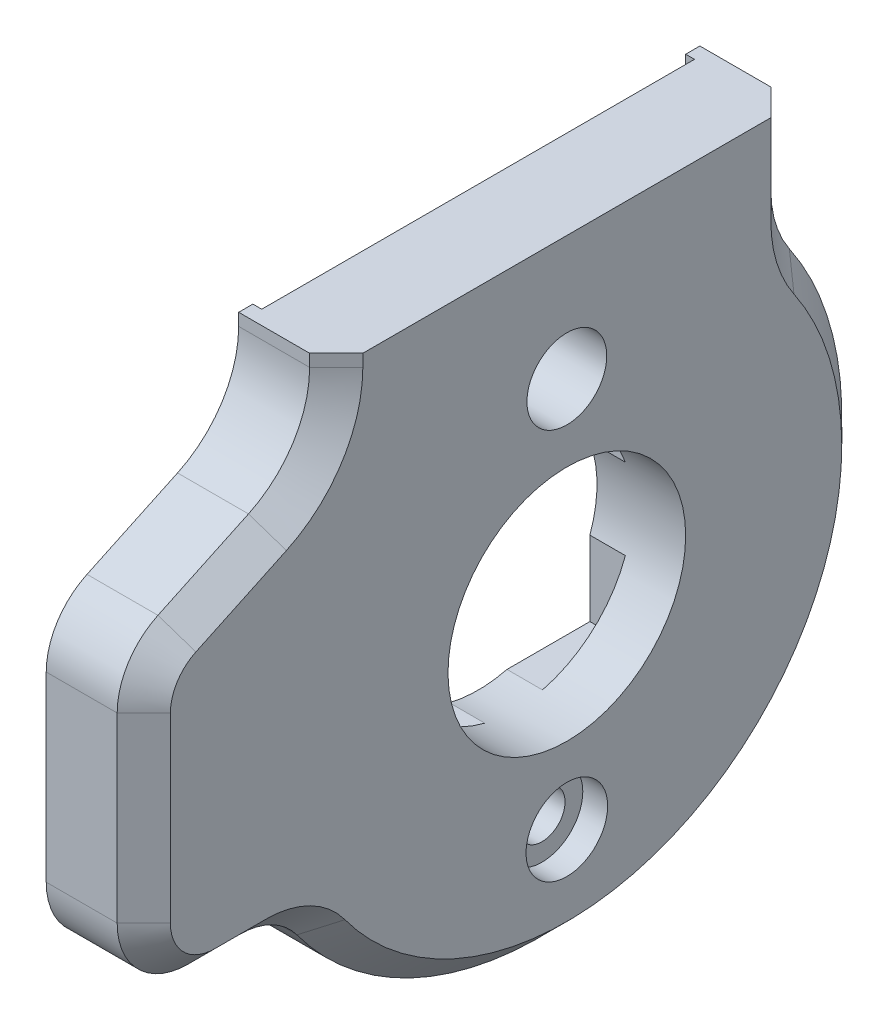
from build123d import *

# Parameters (mm, degrees)
BOSS_EXTRUDE1_START  = 55.1
BOSS_EXTRUDE1_DEPTH  = 5.5
BOSS_EXTRUDE2_START  = 55
BOSS_EXTRUDE2_DEPTH  = 0.6
CHAMFER1_SIZE        = 1.5
BOSS_EXTRUDE3_START  = 55.875
SKETCH3_W            = 4.1
SKETCH3_H            = 2
BOSS_EXTRUDE3_DEPTH  = 2.9
BOSS_EXTRUDE4_START  = 84.025
SKETCH4_W            = 4.1
SKETCH4_H            = 2
BOSS_EXTRUDE4_DEPTH  = 2.9
BOSS_EXTRUDE5_START  = 59.7
SKETCH5_W            = 2.1
SKETCH5_H            = 13
BOSS_EXTRUDE5_DEPTH  = 23.4
BOSS_EXTRUDE6_START  = 55.5
SKETCH6_R            = 6.7
BOSS_EXTRUDE6_DEPTH  = 5.6
BOSS_EXTRUDE7_START  = 55.5
SKETCH7_R            = 2.25
BOSS_EXTRUDE7_DEPTH  = 5.6
BOSS_EXTRUDE8_START  = 59.2
SKETCH8_R            = 2.3
BOSS_EXTRUDE8_DEPTH  = 1.9
BOSS_EXTRUDE9_START  = 55.5
SKETCH9_R            = 1.3
BOSS_EXTRUDE9_DEPTH  = 3.75
BOSS_EXTRUDE10_START = 26
SKETCH10_W           = 30
SKETCH10_H           = 62
BOSS_EXTRUDE10_DEPTH = 80


with BuildPart() as part:
    # Sketch1 → Boss-Extrude1 (new body)
    with BuildSketch(Plane(origin=(0, 0, 0), x_dir=(0, 0, -1), z_dir=(1, 0, 0)).offset(BOSS_EXTRUDE1_START)):
        with BuildLine():
            Line((-53, 3.337121701), (-53, -7.038518603))
            ThreePointArc((-53, -7.038518603), (-52.733198515, -8.807822077), (-51.956521739, -10.41977462))
            ThreePointArc((-51.956521739, -10.41977462), (-56.18950583, -33.883594784), (-79.719936005, -30.038095238))
            ThreePointArc((-79.719936005, -30.038095238), (-81.138131249, -28.832955071), (-82.948156242, -28.4))
            Line((-82.948156242, -28.4), (-85.85, -28.4))
            ThreePointArc((-85.85, -28.4), (-88.678427125, -27.228427125), (-89.85, -24.4))
            Line((-89.85, -24.4), (-89.85, -14.139667829))
            ThreePointArc((-89.85, -14.139667829), (-89.226856881, -11.995644133), (-87.551581196, -10.519637244))
            Line((-87.551581196, -10.519637244), (-82.447628205, -8.120544133))
            ThreePointArc((-82.447628205, -8.120544133), (-79.934714679, -5.9065338), (-79, -2.690498257))
            Line((-79, -2.690498257), (-79, 3.337121701))
            ThreePointArc((-79, 3.337121701), (-79.321091654, 5.273613374), (-80.25, 7.002841276))
            ThreePointArc((-80.25, 7.002841276), (-66, 36), (-51.75, 7.002841276))
            ThreePointArc((-51.75, 7.002841276), (-52.678908346, 5.273613374), (-53, 3.337121701))
        make_face()
    extrude(amount=BOSS_EXTRUDE1_DEPTH)


with BuildPart() as body_2:
    # Sketch2 → Boss-Extrude2 (new body)
    with BuildSketch(Plane(origin=(0, 0, 0), x_dir=(0, 0, -1), z_dir=(1, 0, 0)).offset(BOSS_EXTRUDE2_START)):
        with BuildLine():
            Line((-53.8, 3.337121701), (-53.8, -7.038518603))
            ThreePointArc((-53.8, -7.038518603), (-53.497624984, -9.043729207), (-52.617391304, -10.870608755))
            ThreePointArc((-52.617391304, -10.870608755), (-56.651176143, -33.230249147), (-79.074291958, -29.565714286))
            ThreePointArc((-79.074291958, -29.565714286), (-80.77612625, -28.119546085), (-82.948156242, -27.6))
            Line((-82.948156242, -27.6), (-85.85, -27.6))
            ThreePointArc((-85.85, -27.6), (-88.1127417, -26.6627417), (-89.05, -24.4))
            Line((-89.05, -24.4), (-89.05, -14.139667829))
            ThreePointArc((-89.05, -14.139667829), (-88.551485505, -12.424448872), (-87.211264957, -11.243643361))
            Line((-87.211264957, -11.243643361), (-82.107311966, -8.84455025))
            ThreePointArc((-82.107311966, -8.84455025), (-79.259343303, -6.335338539), (-78.2, -2.690498257))
            Line((-78.2, -2.690498257), (-78.2, 3.337121701))
            ThreePointArc((-78.2, 3.337121701), (-78.563903875, 5.531812264), (-79.616666667, 7.491603886))
            ThreePointArc((-79.616666667, 7.491603886), (-66, 35.2), (-52.383333333, 7.491603886))
            ThreePointArc((-52.383333333, 7.491603886), (-53.436096125, 5.531812264), (-53.8, 3.337121701))
        make_face()
    extrude(amount=BOSS_EXTRUDE2_DEPTH)


with BuildPart() as part_1:
    add(part.part)

    # Combine1: cut body 2
    add(body_2.part, mode=Mode.SUBTRACT)

    # Chamfer1
    chamfer1_edges = [part_1.edges().sort_by_distance(p)[0] for p in [
        (60.6, -5.9065338, 79.934714679),
        (60.6, -9.320090689, 84.999604701),
        (60.6, 0.323311722, 79),
        (60.6, -11.995644133, 89.226856881),
        (60.6, 5.273613374, 79.321091654),
        (60.6, -19.269833914, 89.85),
        (60.6, 36, 66),
        (60.6, -27.228427125, 88.678427125),
        (60.6, 5.273613374, 52.678908346),
        (60.6, -28.4, 84.399078121),
        (60.6, -1.850698451, 53),
        (60.6, -28.832955071, 81.138131249),
        (60.6, -8.807822077, 52.733198515),
        (60.6, -33.883594784, 56.18950583),
    ]]
    chamfer(chamfer1_edges, length=CHAMFER1_SIZE)


with BuildPart() as body_2_2:
    # Sketch3 → Boss-Extrude3 (new body)
    with BuildSketch(Plane.XY.offset(BOSS_EXTRUDE3_START)):
        with Locations((57.55, -20)):
            Rectangle(SKETCH3_W, SKETCH3_H)
    extrude(amount=BOSS_EXTRUDE3_DEPTH)


with BuildPart() as part_2:
    add(part_1.part)

    # Combine2: cut body 2 2
    add(body_2_2.part, mode=Mode.SUBTRACT)


with BuildPart() as body_2_3:
    # Sketch4 → Boss-Extrude4 (new body)
    with BuildSketch(Plane.XY.offset(BOSS_EXTRUDE4_START)):
        with Locations((57.55, -20)):
            Rectangle(SKETCH4_W, SKETCH4_H)
    extrude(amount=BOSS_EXTRUDE4_DEPTH)


with BuildPart() as part_3:
    add(part_2.part)

    # Combine3: cut body 2 3
    add(body_2_3.part, mode=Mode.SUBTRACT)


with BuildPart() as body_2_4:
    # Sketch5 → Boss-Extrude5 (new body)
    with BuildSketch(Plane.XY.offset(BOSS_EXTRUDE5_START)):
        with Locations((56.55, -20)):
            Rectangle(SKETCH5_W, SKETCH5_H)
    extrude(amount=BOSS_EXTRUDE5_DEPTH)


with BuildPart() as part_4:
    add(part_3.part)

    # Combine4: cut body 2 4
    add(body_2_4.part, mode=Mode.SUBTRACT)


with BuildPart() as body_2_5:
    # Sketch6 → Boss-Extrude6 (new body)
    with BuildSketch(Plane(origin=(0, 0, 0), x_dir=(0, 0, -1), z_dir=(1, 0, 0)).offset(BOSS_EXTRUDE6_START)):
        with Locations((-66, -20)):
            Circle(SKETCH6_R)
    extrude(amount=BOSS_EXTRUDE6_DEPTH)


with BuildPart() as part_5:
    add(part_4.part)

    # Combine5: cut body 2 5
    add(body_2_5.part, mode=Mode.SUBTRACT)


with BuildPart() as body_2_6:
    # Sketch7 → Boss-Extrude7 (new body)
    with BuildSketch(Plane(origin=(0, 0, 0), x_dir=(0, 0, -1), z_dir=(1, 0, 0)).offset(BOSS_EXTRUDE7_START)):
        with Locations((-66, -9)):
            Circle(SKETCH7_R)
    extrude(amount=BOSS_EXTRUDE7_DEPTH)


with BuildPart() as part_6:
    add(part_5.part)

    # Combine6: cut body 2 6
    add(body_2_6.part, mode=Mode.SUBTRACT)


with BuildPart() as body_2_7:
    # Sketch8 → Boss-Extrude8 (new body)
    with BuildSketch(Plane(origin=(0, 0, 0), x_dir=(0, 0, -1), z_dir=(1, 0, 0)).offset(BOSS_EXTRUDE8_START)):
        with Locations((-66, -31)):
            Circle(SKETCH8_R)
    extrude(amount=BOSS_EXTRUDE8_DEPTH)


with BuildPart() as part_7:
    add(part_6.part)

    # Combine7: cut body 2 7
    add(body_2_7.part, mode=Mode.SUBTRACT)


with BuildPart() as body_2_8:
    # Sketch9 → Boss-Extrude9 (new body)
    with BuildSketch(Plane(origin=(0, 0, 0), x_dir=(0, 0, -1), z_dir=(1, 0, 0)).offset(BOSS_EXTRUDE9_START)):
        with Locations((-66, -31)):
            Circle(SKETCH9_R)
    extrude(amount=BOSS_EXTRUDE9_DEPTH)


with BuildPart() as part_8:
    add(part_7.part)

    # Combine8: cut body 2 8
    add(body_2_8.part, mode=Mode.SUBTRACT)


with BuildPart() as body_2_9:
    # Sketch10 → Boss-Extrude10 (new body)
    with BuildSketch(Plane.XY.offset(BOSS_EXTRUDE10_START)):
        with Locations((55, 29)):
            Rectangle(SKETCH10_W, SKETCH10_H)
    extrude(amount=BOSS_EXTRUDE10_DEPTH)


with BuildPart() as part_9:
    add(part_8.part)

    # Combine9: cut body 2 9
    add(body_2_9.part, mode=Mode.SUBTRACT)


solid = part_9.part
